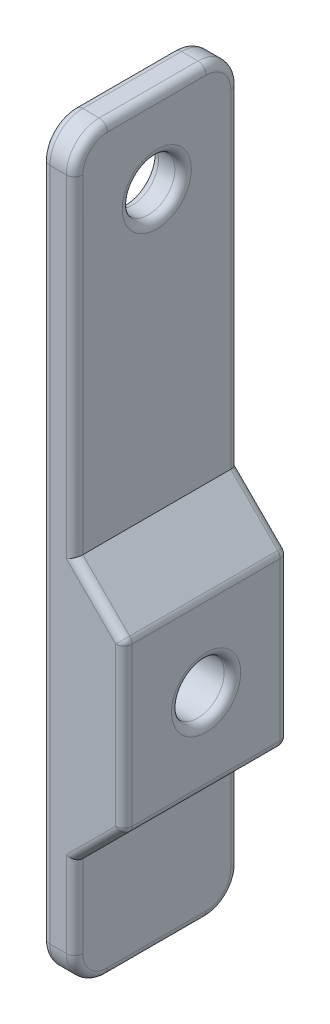
from build123d import *

# Parameters (mm, degrees)
EXTRUDE_1_DEPTH     = 10
SKETCH_2_R          = 1.6
CUT_EXTRUDE_1_DEPTH = 47.368092477
FILLET_8_R          = 0.5
FILLET_6_R          = 2
FILLET_9_R          = 0.5
FILLET_10_R         = 0.5


with BuildPart() as part:
    # Эскиз1 → Бобышка-Вытянуть1 (new body)
    with BuildSketch(Plane.XY):
        Polygon((0, 0), (2, 0), (2, 7), (5, 10), (5, 20), (2, 23), (2, 45), (0, 45), align=None)
    extrude(amount=EXTRUDE_1_DEPTH)

    # Эскиз2 → Вырез-Вытянуть1 (cut, through all)
    with BuildSketch(Plane.ZY):
        with Locations(Location((5, 15, 0), (0, 0, 270))):
            Circle(SKETCH_2_R)
        with Locations(Location((5, 40, 0), (0, 0, 270))):
            Circle(SKETCH_2_R)
    extrude(amount=-CUT_EXTRUDE_1_DEPTH, mode=Mode.SUBTRACT)

    # Скругление8
    fillet_8_edges = [part.edges().sort_by_distance(p)[0] for p in [
        (3.5, 8.5, 10),
        (5, 20, 5),
        (5, 10, 5),
        (5, 15, 10),
        (3.5, 21.5, 10),
        (3.5, 21.5, 0),
        (5, 15, 0),
        (3.5, 8.5, 0),
    ]]
    fillet(fillet_8_edges, radius=FILLET_8_R)

    # Скругление6
    fillet_6_edges = [part.edges().sort_by_distance(p)[0] for p in [
        (1, 0, 0),
        (1, 45, 10),
        (1, 0, 10),
        (1, 45, 0),
    ]]
    fillet(fillet_6_edges, radius=FILLET_6_R)

    # Скругление9
    fillet_9_edges = [part.edges().sort_by_distance(p)[0] for p in [
        (0, 44.414213562, 0.585786438),
        (0, 45, 5),
        (0, 44.414213562, 9.414213562),
        (0, 22.5, 10),
        (0, 0.585786438, 9.414213562),
        (0, 0, 5),
        (0, 0.585786438, 0.585786438),
        (2, 32.646446609, 10),
        (2, 44.414213562, 9.414213562),
        (2, 32.646446609, 0),
        (2, 44.414213562, 0.585786438),
        (2, 4.853553391, 10),
        (2, 0.585786438, 9.414213562),
        (2, 4.853553391, 0),
        (2, 0.585786438, 0.585786438),
        (0, 22.5, 0),
        (2, 45, 5),
        (2, 0, 5),
    ]]
    fillet(fillet_9_edges, radius=FILLET_9_R)

    # Скругление10
    fillet_10_edges = [part.edges().sort_by_distance(p)[0] for p in [
        (5, 16.6, 5),
        (0, 16.6, 5),
        (2, 41.6, 5),
        (0, 41.6, 5),
    ]]
    fillet(fillet_10_edges, radius=FILLET_10_R)


solid = part.part
